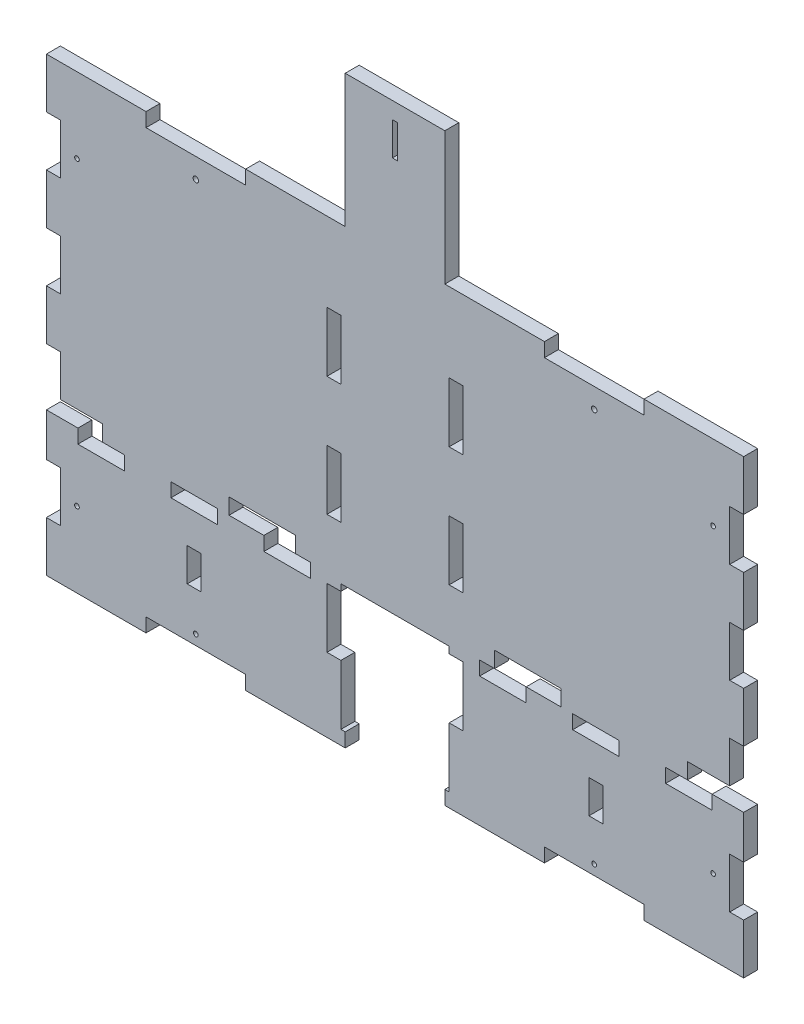
from build123d import *

# Parameters (mm, degrees)
SKETCH1_W           = 266.7
SKETCH1_H           = 172.72
BOSS_EXTRUDE1_DEPTH = 5.334
SKETCH2_W           = 38.1
SKETCH2_H           = 5.334
CUT_EXTRUDE1_DEPTH  = 165.701204222
SKETCH5_W           = 25.4
SKETCH5_H           = 6.096
SKETCH5_W_2         = 21.477624924
SKETCH5_W_3         = 21.477624925
CUT_EXTRUDE3_DEPTH  = 165.701204222
SKETCH9_W           = 5.334
SKETCH9_H           = 19.191111111
CUT_EXTRUDE7_DEPTH  = 165.701204222
SKETCH10_W          = 38.1
SKETCH10_H          = 5.334
BOSS_EXTRUDE2_DEPTH = 50.8
SKETCH11_W          = 6.604
SKETCH11_H          = 40.64
CUT_EXTRUDE8_DEPTH  = 197.710659379
SKETCH12_R          = 3.81
CUT_EXTRUDE9_DEPTH  = 197.710659379
SKETCH15_W          = 6.604
SKETCH15_H          = 10.16
CUT_EXTRUDE12_DEPTH = 197.710659379
SKETCH18_W          = 38.1
SKETCH18_H          = 56.134
BOSS_EXTRUDE3_DEPTH = 5.334
SKETCH19_W          = 34.756768033
SKETCH19_H          = 54.94363668
CUT_EXTRUDE15_DEPTH = 197.710659379
SKETCH21_R          = 0.889
CUT_EXTRUDE17_DEPTH = 197.710659379
SKETCH23_R          = 1.04775
CUT_EXTRUDE19_DEPTH = 197.710659379
SKETCH25_W          = 17.78
SKETCH25_H          = 5.334
CUT_EXTRUDE20_DEPTH = 197.710659379
SKETCH26_W          = 5.334
SKETCH26_H          = 12.7
CUT_EXTRUDE21_DEPTH = 197.710659379
SKETCH27_W          = 41.402
SKETCH27_H          = 48.26
CUT_EXTRUDE22_DEPTH = 197.710659379
SKETCH28_W          = 5.334
SKETCH28_H          = 22.86
CUT_EXTRUDE23_DEPTH = 197.710659379
SKETCH29_R          = 0.889
CUT_EXTRUDE24_DEPTH = 197.710659379
SKETCH30_W          = 2.032
SKETCH30_H          = 12.7
CUT_EXTRUDE25_DEPTH = 197.710659379


with BuildPart() as part:
    # Sketch1 → Boss-Extrude1 (new body)
    with BuildSketch(Plane.XY):
        with Locations((5.474099752, 2.104142138)):
            Rectangle(SKETCH1_W, SKETCH1_H)
    extrude(amount=BOSS_EXTRUDE1_DEPTH)

    # Sketch2 → Cut-Extrude1 (cut, through all)
    with BuildSketch(Plane.XY.offset(5.334)):
        with Locations((-70.725900248, -81.588857862)):
            Rectangle(SKETCH2_W, SKETCH2_H)
        with Locations((5.474099752, -81.588857862)):
            Rectangle(SKETCH2_W, SKETCH2_H)
        with Locations((81.674099752, -81.588857862)):
            Rectangle(SKETCH2_W, SKETCH2_H)
        with Locations((81.674099752, 85.797142138)):
            Rectangle(SKETCH2_W, SKETCH2_H)
        with Locations((5.474099752, 85.797142138)):
            Rectangle(SKETCH2_W, SKETCH2_H)
        with Locations((-70.725900248, 85.797142138)):
            Rectangle(SKETCH2_W, SKETCH2_H)
    extrude(amount=-CUT_EXTRUDE1_DEPTH, mode=Mode.SUBTRACT)

    # Sketch5 → Cut-Extrude3 (cut, through all)
    with BuildSketch(Plane.XY.offset(5.334)):
        with Locations((56.274099752, -26.343857862)):
            Rectangle(SKETCH5_W, SKETCH5_H)
        with Locations((-45.325900248, -26.343857862)):
            Rectangle(SKETCH5_W, SKETCH5_H)
        with Locations((-117.137087786, -26.343857862)):
            Rectangle(SKETCH5_W_2, SKETCH5_H)
        with Locations((128.08528729, -26.343857862)):
            Rectangle(SKETCH5_W_3, SKETCH5_H)
    extrude(amount=-CUT_EXTRUDE3_DEPTH, mode=Mode.SUBTRACT)

    # Sketch9 → Cut-Extrude7 (cut, through all)
    with BuildSketch(Plane.XY.offset(5.334)):
        with Locations((-125.208900248, -55.469191196)):
            Rectangle(SKETCH9_W, SKETCH9_H)
        with Locations((-125.208900248, -17.086968973)):
            Rectangle(SKETCH9_W, SKETCH9_H)
        with Locations((-125.208900248, 21.295253249)):
            Rectangle(SKETCH9_W, SKETCH9_H)
        with Locations((-125.208900248, 59.677475472)):
            Rectangle(SKETCH9_W, SKETCH9_H)
        with Locations((136.157099752, 59.677475472)):
            Rectangle(SKETCH9_W, SKETCH9_H)
        with Locations((136.157099752, 21.295253249)):
            Rectangle(SKETCH9_W, SKETCH9_H)
        with Locations((136.157099752, -17.086968973)):
            Rectangle(SKETCH9_W, SKETCH9_H)
        with Locations((136.157099752, -55.469191196)):
            Rectangle(SKETCH9_W, SKETCH9_H)
    extrude(amount=-CUT_EXTRUDE7_DEPTH, mode=Mode.SUBTRACT)

    # Sketch10 → Boss-Extrude2 (add)
    with BuildSketch(Plane(origin=(0, 88.464142138, 0), x_dir=(1, 0, 0), z_dir=(0, 1, 0))):
        with Locations((43.574099752, -2.667)):
            Rectangle(SKETCH10_W, SKETCH10_H)
    extrude(amount=BOSS_EXTRUDE2_DEPTH)

    # Sketch11 → Cut-Extrude8 (cut, through all)
    with BuildSketch(Plane(origin=(0, 0, 0), x_dir=(-1, 0, 0), z_dir=(0, 0, -1))):
        with Locations((-27.826099752, 108.784142138)):
            Rectangle(SKETCH11_W, SKETCH11_H)
    extrude(amount=-CUT_EXTRUDE8_DEPTH, mode=Mode.SUBTRACT)

    # Sketch12 → Cut-Extrude9 (cut, through all)
    with BuildSketch(Plane.XY.offset(5.334)):
        with Locations((43.574099752, 130.476471297)):
            Circle(SKETCH12_R)
    extrude(amount=-CUT_EXTRUDE9_DEPTH, mode=Mode.SUBTRACT)

    # Sketch15 → Cut-Extrude12 (cut, through all)
    with BuildSketch(Plane.XY.offset(5.334)):
        with Locations((27.826099752, 134.184142138)):
            Rectangle(SKETCH15_W, SKETCH15_H)
    extrude(amount=-CUT_EXTRUDE12_DEPTH, mode=Mode.SUBTRACT)

    # Sketch18 → Boss-Extrude3 (add)
    with BuildSketch(Plane.XY.offset(5.334)):
        with Locations((5.474099752, 111.197142138)):
            Rectangle(SKETCH18_W, SKETCH18_H)
    extrude(amount=-BOSS_EXTRUDE3_DEPTH)

    # Sketch19 → Cut-Extrude15 (cut, through all)
    with BuildSketch(Plane.XY.offset(5.334)):
        with Locations((48.506483768, 115.935960478)):
            Rectangle(SKETCH19_W, SKETCH19_H)
    extrude(amount=-CUT_EXTRUDE15_DEPTH, mode=Mode.SUBTRACT)

    # Sketch21 → Cut-Extrude17 (cut, through all)
    with BuildSketch(Plane.XY.offset(5.334)):
        with Locations((127.140099752, 59.677475471)):
            Circle(SKETCH21_R)
        with Locations(Location((-116.191900248, 59.677475471, 0), (0, 0, 180))):
            Circle(SKETCH21_R)
        with Locations((-116.191900248, -55.469191196)):
            Circle(SKETCH21_R)
        with Locations(Location((127.140099752, -55.469191196, 0), (0, 0, 180))):
            Circle(SKETCH21_R)
    extrude(amount=-CUT_EXTRUDE17_DEPTH, mode=Mode.SUBTRACT)

    # Sketch23 → Cut-Extrude19 (cut, through all)
    with BuildSketch(Plane(origin=(0, 0, 0), x_dir=(-1, 0, 0), z_dir=(0, 0, -1))):
        with Locations((-81.674099752, 75.510142138)):
            Circle(SKETCH23_R)
        with Locations(Location((70.725900248, 75.510142138, 0), (0, 0, 180))):
            Circle(SKETCH23_R)
    extrude(amount=-CUT_EXTRUDE19_DEPTH, mode=Mode.SUBTRACT)

    # Sketch25 → Cut-Extrude20 (cut, through all)
    with BuildSketch(Plane(origin=(0, 0, 0), x_dir=(-1, 0, 0), z_dir=(0, 0, -1))):
        with Locations((-117.869099752, -32.058857862)):
            Rectangle(SKETCH25_W, SKETCH25_H)
        with Locations((-82.309099752, -32.058857862)):
            Rectangle(SKETCH25_W, SKETCH25_H)
        with Locations((-46.749099752, -32.058857862)):
            Rectangle(SKETCH25_W, SKETCH25_H)
        with Locations((35.800900248, -32.058857862)):
            Rectangle(SKETCH25_W, SKETCH25_H)
        with Locations((106.920900248, -32.058857862)):
            Rectangle(SKETCH25_W, SKETCH25_H)
        with Locations((71.360900248, -32.058857862)):
            Rectangle(SKETCH25_W, SKETCH25_H)
    extrude(amount=-CUT_EXTRUDE20_DEPTH, mode=Mode.SUBTRACT)

    # Sketch26 → Cut-Extrude21 (cut, through all)
    with BuildSketch(Plane(origin=(0, 0, 0), x_dir=(-1, 0, 0), z_dir=(0, 0, -1))):
        with Locations((-82.309099752, -53.775857862)):
            Rectangle(SKETCH26_W, SKETCH26_H)
        with Locations((71.360900248, -53.775857862)):
            Rectangle(SKETCH26_W, SKETCH26_H)
    extrude(amount=-CUT_EXTRUDE21_DEPTH, mode=Mode.SUBTRACT)

    # Sketch27 → Cut-Extrude22 (cut, through all)
    with BuildSketch(Plane(origin=(0, 0, 0), x_dir=(-1, 0, 0), z_dir=(0, 0, -1))):
        with Locations((-5.474099752, -54.791857862)):
            Rectangle(SKETCH27_W, SKETCH27_H)
    extrude(amount=-CUT_EXTRUDE22_DEPTH, mode=Mode.SUBTRACT)

    # Sketch28 → Cut-Extrude23 (cut, through all)
    with BuildSketch(Plane(origin=(0, 0, 0), x_dir=(-1, 0, 0), z_dir=(0, 0, -1))):
        with Locations((-28.842099752, -44.631857862)):
            Rectangle(SKETCH28_W, SKETCH28_H)
        with Locations((-28.842099752, 1.088142138)):
            Rectangle(SKETCH28_W, SKETCH28_H)
        with Locations((-28.842099752, 46.808142138)):
            Rectangle(SKETCH28_W, SKETCH28_H)
        with Locations((17.893900248, 46.808142138)):
            Rectangle(SKETCH28_W, SKETCH28_H)
        with Locations((17.893900248, 1.088142138)):
            Rectangle(SKETCH28_W, SKETCH28_H)
        with Locations((17.893900248, -44.631857862)):
            Rectangle(SKETCH28_W, SKETCH28_H)
    extrude(amount=-CUT_EXTRUDE23_DEPTH, mode=Mode.SUBTRACT)

    # Sketch29 → Cut-Extrude24 (cut, through all)
    with BuildSketch(Plane(origin=(0, 0, 0), x_dir=(-1, 0, 0), z_dir=(0, 0, -1))):
        with Locations((-81.674099752, -75.111857862)):
            Circle(SKETCH29_R)
        with Locations(Location((70.725900248, -75.111857862, 0), (0, 0, 180))):
            Circle(SKETCH29_R)
    extrude(amount=-CUT_EXTRUDE24_DEPTH, mode=Mode.SUBTRACT)

    # Sketch30 → Cut-Extrude25 (cut, through all)
    with BuildSketch(Plane(origin=(0, 0, 0), x_dir=(-1, 0, 0), z_dir=(0, 0, -1))):
        with Locations((-5.474099752, 126.564142138)):
            Rectangle(SKETCH30_W, SKETCH30_H)
    extrude(amount=-CUT_EXTRUDE25_DEPTH, mode=Mode.SUBTRACT)


solid = part.part
